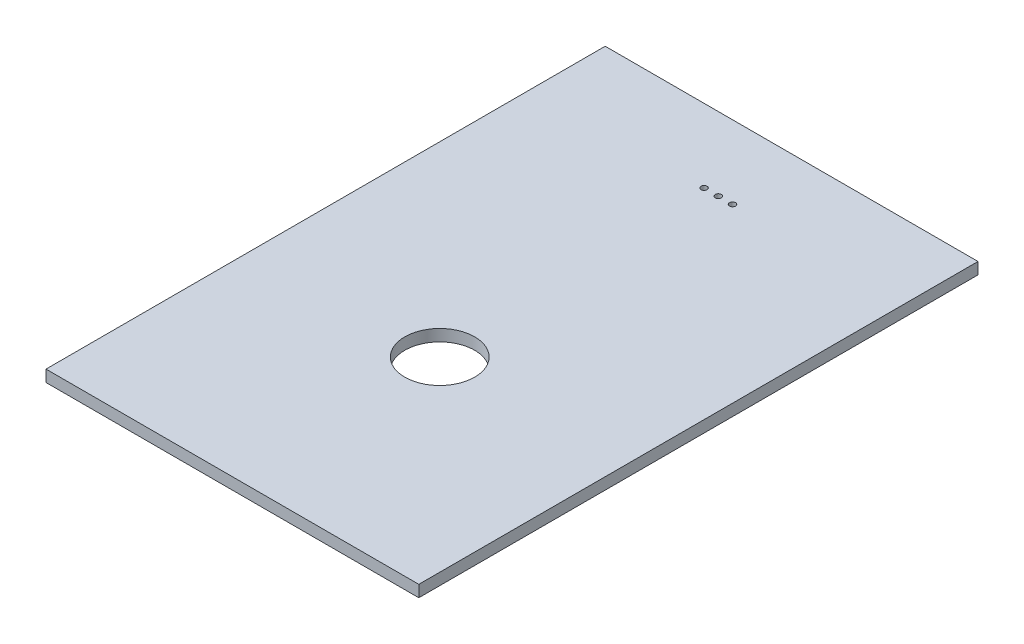
from build123d import *

# Parameters (mm, degrees)
SKETCH3_W           = 203.2
SKETCH3_H           = 6.35
BOSS_EXTRUDE1_DEPTH = 152.4
SKETCH5_R           = 1.65
SKETCH5_R_2         = 1.650000002
CUT_EXTRUDE1_DEPTH  = 25400
SKETCH7_R           = 3.52552
CUT_EXTRUDE2_DEPTH  = 2.79908
SKETCH8_R           = 19.05
CUT_EXTRUDE3_DEPTH  = 184.272045059


with BuildPart() as part:
    # Sketch3 → Boss-Extrude1 (new, symmetric)
    with BuildSketch(Plane.XY):
        Rectangle(SKETCH3_W, SKETCH3_H)
    extrude(amount=BOSS_EXTRUDE1_DEPTH, both=True)

    # Sketch5 → Cut-Extrude1 (cut)
    with BuildSketch(Plane(origin=(0, 3.175, 0), x_dir=(1, 0, 0), z_dir=(0, 1, 0))):
        with Locations(Location((7.746566692, 112.45, 0), (0, 0, 270))):
            Circle(SKETCH5_R)
        with Locations(Location((-7.745366692, 112.45, 0), (0, 0, 270))):
            Circle(SKETCH5_R_2)
        with Locations(Location((0.0006, 112.45, 0), (0, 0, 270))):
            Circle(SKETCH5_R)
    extrude(amount=-CUT_EXTRUDE1_DEPTH, mode=Mode.SUBTRACT)

    # Sketch7 → Cut-Extrude2 (cut)
    with BuildSketch(Plane(origin=(0, -3.175, 0), x_dir=(1, 0, 0), z_dir=(0, 1, 0))):
        with Locations(Location((7.746566692, 112.45, 0), (0, 0, 270))):
            Circle(SKETCH7_R)
        with Locations(Location((0.0006, 112.45, 0), (0, 0, 270))):
            Circle(SKETCH7_R)
        with Locations(Location((-7.745366692, 112.45, 0), (0, 0, 270))):
            Circle(SKETCH7_R)
    extrude(amount=CUT_EXTRUDE2_DEPTH, mode=Mode.SUBTRACT)

    # Sketch8 → Cut-Extrude3 (cut, through all)
    with BuildSketch(Plane(origin=(0, 3.175, 0), x_dir=(1, 0, 0), z_dir=(0, 1, 0))):
        with Locations(Location((0, -39.38524, 0), (0, 0, 270))):
            Circle(SKETCH8_R)
    extrude(amount=-CUT_EXTRUDE3_DEPTH, mode=Mode.SUBTRACT)


solid = part.part
